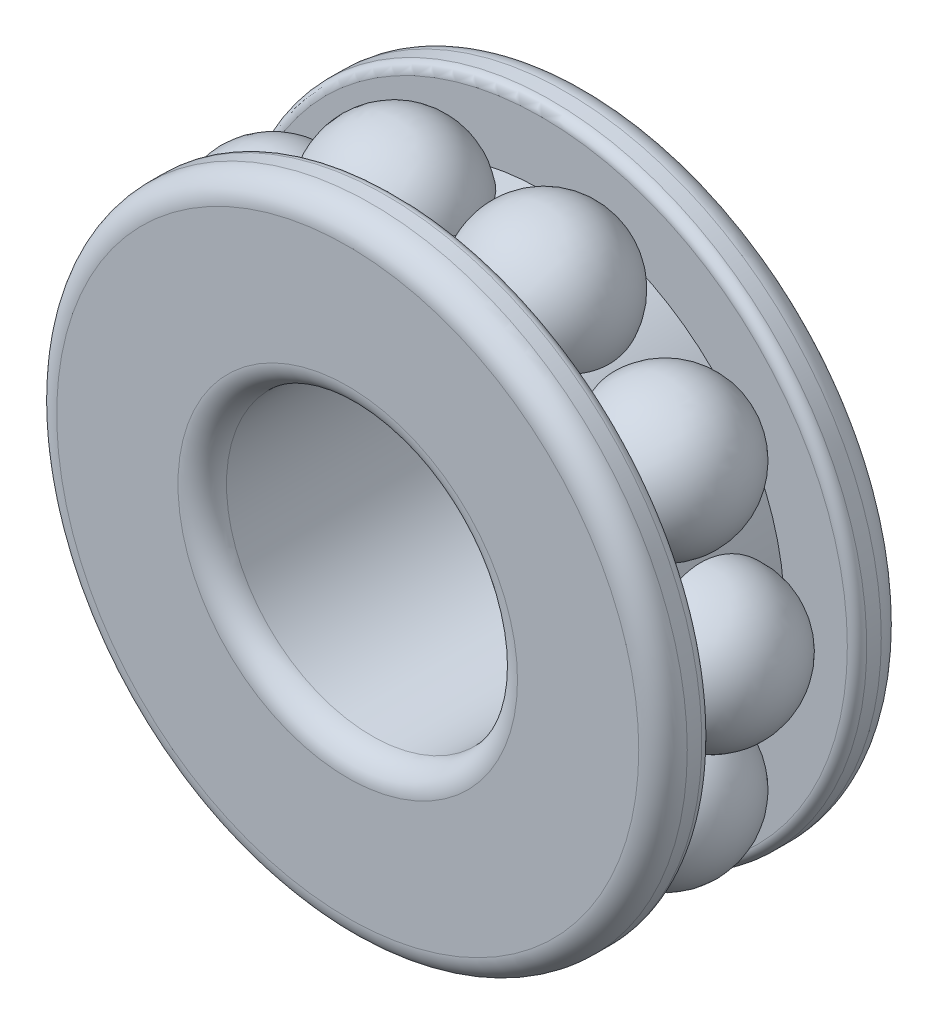
from build123d import *

# Parameters (mm, degrees)
SKIZZE1_R                            = 6.5
SKIZZE1_R_2                          = 3
AUFSATZ_LINEAR_AUSTRAGEN1_DEPTH      = 5
VERRUNDUNG1_R                        = 0.5
SCHNITT_LINEAR_AUSTRAGEN1_DEPTH      = 1.5
SCHNITT_LINEAR_AUSTRAGEN1_DEPTH_BACK = 1.5
SKIZZE2_R                            = 8.216719383
SKIZZE2_R_2                          = 5
KREISMUSTER3_COUNT                   = 10
VERRUNDUNG2_R                        = 0.2


with BuildPart() as part:
    # Skizze1 → Aufsatz-Linear austragen1 (new body)
    with BuildSketch(Plane.XY):
        Circle(SKIZZE1_R)
        Circle(SKIZZE1_R_2, mode=Mode.SUBTRACT)
    extrude(amount=AUFSATZ_LINEAR_AUSTRAGEN1_DEPTH)

    # Verrundung1
    verrundung1_edges = [part.edges().sort_by_distance(p)[0] for p in [
        (-6.5, 0, 0),
        (-6.5, 0, 5),
        (-3, 0, 0),
        (-3, 0, 5),
    ]]
    fillet(verrundung1_edges, radius=VERRUNDUNG1_R)

    # Skizze2 → Schnitt-Linear austragen1 (cut, two sides: drawn at the far end of the back side and taken through both)
    with BuildSketch(Plane(origin=(0, 0, 2.5), x_dir=(-1, 0, 0), z_dir=(0, 0, -1)).offset(-SCHNITT_LINEAR_AUSTRAGEN1_DEPTH_BACK)):
        Circle(SKIZZE2_R)
        Circle(SKIZZE2_R_2, mode=Mode.SUBTRACT)
    extrude(amount=SCHNITT_LINEAR_AUSTRAGEN1_DEPTH + SCHNITT_LINEAR_AUSTRAGEN1_DEPTH_BACK, mode=Mode.SUBTRACT)

    # Skizze3 → Rotation1 (revolve)
    with BuildSketch(Plane(origin=(0, 0, 2.5), x_dir=(-1, 0, 0), z_dir=(0, 0, -1))):
        with BuildLine():
            Line((-5, 1.5), (-5, -1.5))
            ThreePointArc((-5, -1.5), (-6.5, 0), (-5, 1.5))
        make_face()
    rotation1 = revolve(axis=Axis((5, 1.5, 2.5), (0, -1, 0)))

    # Kreismuster3: Rotation1 ×10 about axis
    kreismuster3_axis = Axis((0, 0, 0), (0, 0, 1))
    for i in range(1, KREISMUSTER3_COUNT):
        add(rotation1.rotate(kreismuster3_axis, i * 360 / KREISMUSTER3_COUNT))

    # Verrundung2
    verrundung2_edges = [part.edges().sort_by_distance(p)[0] for p in [
        (-6.5, 0, 1),
        (-6.5, 0, 4),
    ]]
    fillet(verrundung2_edges, radius=VERRUNDUNG2_R)


solid = part.part
